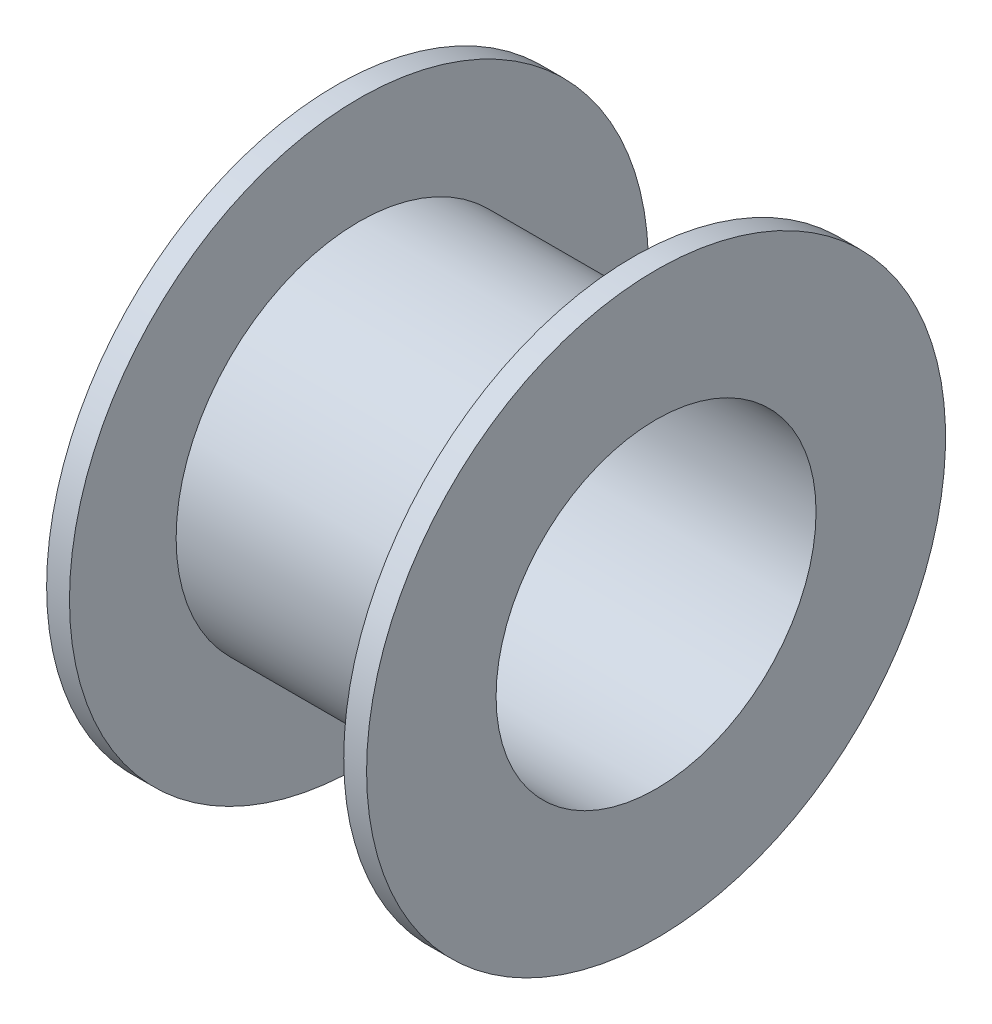
from build123d import *


with BuildPart() as part:
    # Эскиз1 → Повернуть1 (revolve)
    with BuildSketch(Plane.XY, mode=Mode.PRIVATE) as revolve_1_sk:
        Polygon((19.5, 19), (21, 19), (21, 10.5), (0, 10.5), (0, 19), (1.5, 19), (1.5, 12), (19.5, 12), align=None)
    revolve(revolve_1_sk.sketch.rotate(Axis((-23.837125129, 0, 0), (1, 0, 0)), 90), axis=Axis((-23.837125129, 0, 0), (1, 0, 0)))


solid = part.part
